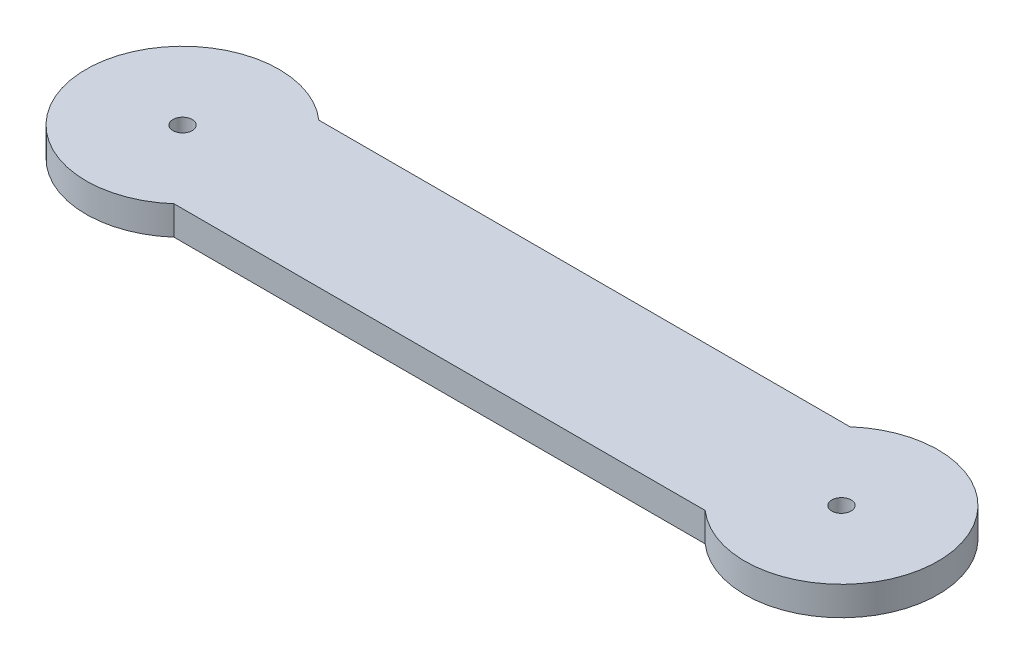
from build123d import *

# Parameters (mm, degrees)
BOSS_EXTRUDE1_DEPTH = 3
SKETCH2_R           = 1
CUT_EXTRUDE1_DEPTH  = 23


with BuildPart() as part:
    # Sketch1 → Boss-Extrude1 (new body)
    with BuildSketch(Plane(origin=(0, 0, 0), x_dir=(1, 0, 0), z_dir=(0, 1, 0))):
        with BuildLine():
            Line((0, 0), (-55, 0))
            ThreePointArc((-55, 0), (-71.614378278, 7.5), (-55, 15))
            Line((-55, 15), (0, 15))
            ThreePointArc((0, 15), (16.614378278, 7.5), (0, 0))
        make_face()
    extrude(amount=BOSS_EXTRUDE1_DEPTH)

    # Sketch2 → Cut-Extrude1 (cut)
    with BuildSketch(Plane(origin=(0, 3, 0), x_dir=(1, 0, 0), z_dir=(0, 1, 0))):
        with Locations(Location((-61.614378278, 7.5, 0), (0, 0, 270))):
            Circle(SKETCH2_R)
        with Locations(Location((6.614378278, 7.5, 0), (0, 0, 270))):
            Circle(SKETCH2_R)
    extrude(amount=-CUT_EXTRUDE1_DEPTH, mode=Mode.SUBTRACT)


solid = part.part
